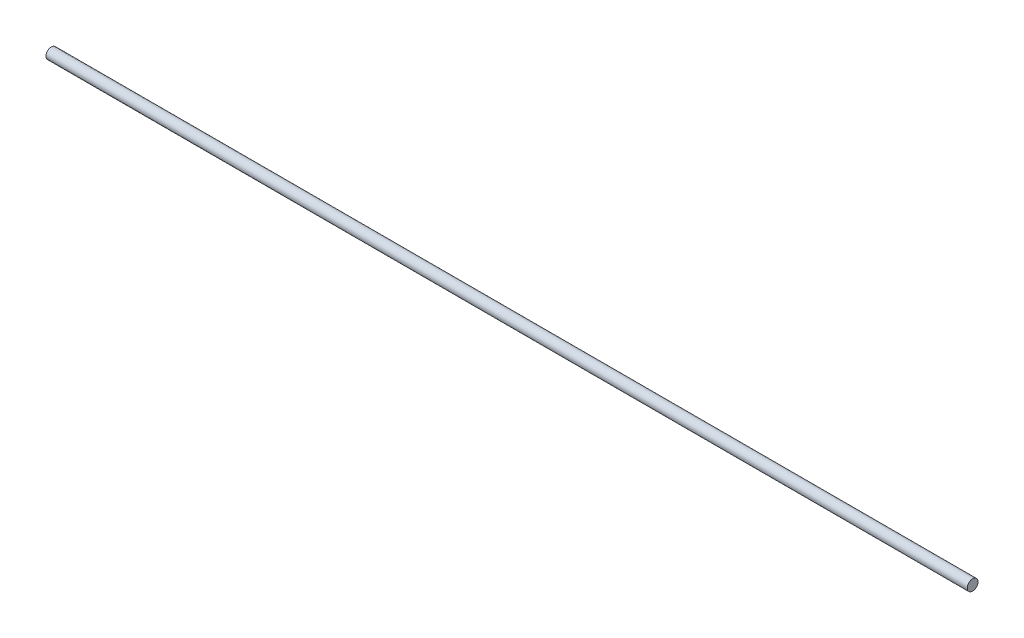
from build123d import *

# Parameters (mm, degrees)
SKETCH1_R           = 0.875
BOSS_EXTRUDE1_DEPTH = 150


with BuildPart() as part:
    # Sketch1 → Boss-Extrude1 (new body)
    with BuildSketch(Plane(origin=(0, 0, 0), x_dir=(0, 0, -1), z_dir=(1, 0, 0))):
        Circle(SKETCH1_R)
    extrude(amount=BOSS_EXTRUDE1_DEPTH)


solid = part.part
